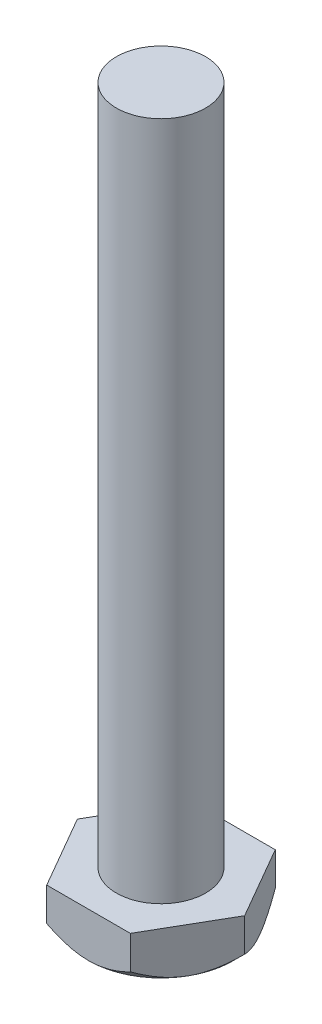
from build123d import *

# Parameters (mm, degrees)
BOSS_EXTRUDE1_DEPTH = 4
SKETCH2_OUTSIDE_W   = 44.472
SKETCH2_OUTSIDE_H   = 42.46
SKETCH2_OUTSIDE_R   = 6.5
CUT_EXTRUDE2_DEPTH  = 11.704360482
CUT_EXTRUDE2_DRAFT  = -45
SKETCH3_R           = 4
BOSS_EXTRUDE2_DEPTH = 61


with BuildPart() as part:
    # Sketch1 → Boss-Extrude1 (new body)
    with BuildSketch(Plane(origin=(0, 0, 0), x_dir=(1, 0, 0), z_dir=(0, 1, 0))):
        Polygon((7.505553499, 0), (3.75277675, 6.5), (-3.75277675, 6.5), (-7.505553499, 0), (-3.75277675, -6.5), (3.75277675, -6.5), align=None)
    extrude(amount=BOSS_EXTRUDE1_DEPTH)


with BuildPart() as cut_extrude2_tool:
    # Sketch2 outside → Cut-Extrude2 (with draft: the straight prism first)
    with BuildSketch(Plane(origin=(0, 0, 0), x_dir=(-1, 0, 0), z_dir=(0, -1, 0))):
        Rectangle(SKETCH2_OUTSIDE_W, SKETCH2_OUTSIDE_H)
        Circle(SKETCH2_OUTSIDE_R, mode=Mode.SUBTRACT)
    extrude(amount=-CUT_EXTRUDE2_DEPTH)
    # Cut-Extrude2: the draft: its side faces are tilted about the plane it starts from
    cut_extrude2_sides = [cut_extrude2_tool.faces().sort_by_distance(p)[0] for p in [
        (0, 5.852180241, 21.23),
        (-22.236, 5.852180241, 0),
        (0, 5.852180241, -21.23),
        (22.236, 5.852180241, 0),
        (6.5, 5.852180241, 0),
    ]]
    draft(cut_extrude2_sides, Plane(origin=(0, 0, 0), x_dir=(-1, 0, 0), z_dir=(0, -1, 0)), CUT_EXTRUDE2_DRAFT)


with BuildPart() as part_1:
    add(part.part)

    # Cut-Extrude2: cut by cut_extrude2_tool
    add(cut_extrude2_tool.part, mode=Mode.SUBTRACT)

    # Sketch3 → Boss-Extrude2 (add)
    with BuildSketch(Plane(origin=(0, 4, 0), x_dir=(1, 0, 0), z_dir=(0, 1, 0))):
        with Locations(Location((0, 0, 0), (0, 0, 90))):
            Circle(SKETCH3_R)
    extrude(amount=BOSS_EXTRUDE2_DEPTH)


solid = part_1.part
